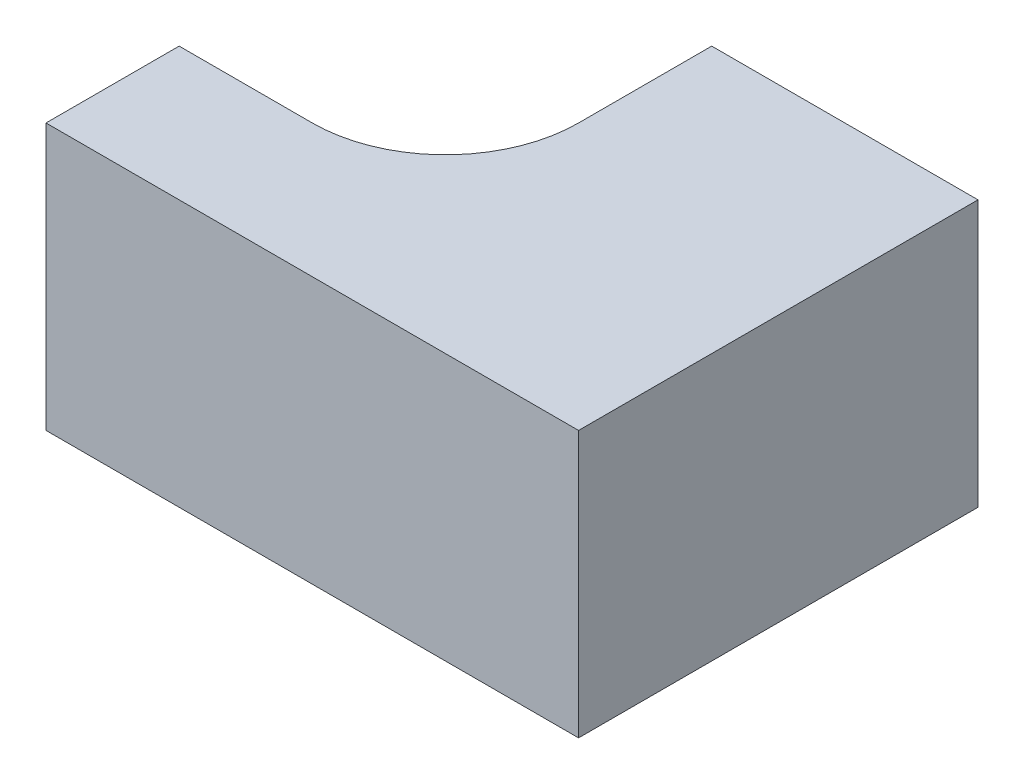
from build123d import *

# Parameters (mm, degrees)
BOSS_EXTRUDE1_DEPTH = 20


with BuildPart() as part:
    # Sketch2 → Boss-Extrude1 (new body)
    with BuildSketch(Plane(origin=(0, 0, 0), x_dir=(1, 0, 0), z_dir=(0, 1, 0))):
        with BuildLine():
            Line((0, 0), (0, -10))
            ThreePointArc((0, -10), (2.928932188, -17.071067812), (10, -20))
            Line((10, -20), (20, -20))
            Line((20, -20), (20, -30))
            Line((20, -30), (-20, -30))
            Line((-20, -30), (-20, 0))
            Line((-20, 0), (0, 0))
        make_face()
    extrude(amount=BOSS_EXTRUDE1_DEPTH)


with BuildPart() as body_2:
    # Mirror1: mirrored copy
    add(part.part.mirror(Plane(origin=(-20, 20, 30), x_dir=(0, 0, 1), z_dir=(1, 0, 0))))


solid = body_2.part
